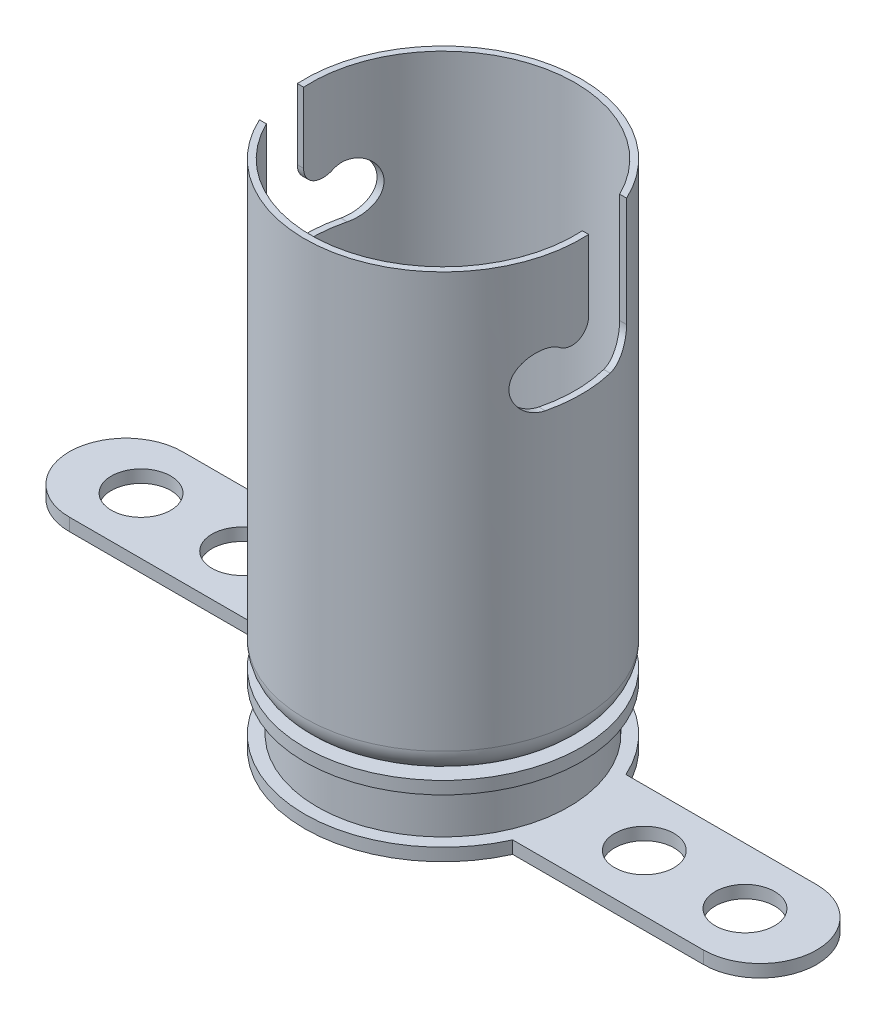
from build123d import *

# Parameters (mm, degrees)
SKETCH2_R           = 1.18
BOSS_EXTRUDE1_DEPTH = 0.5
SKETCH3_R           = 1.18
BOSS_EXTRUDE2_DEPTH = 0.5
CUT_EXTRUDE1_DEPTH  = 10
CIRPATTERN1_COUNT   = 2
CIRPATTERN1_ANGLE   = 180


with BuildPart() as part:
    # Sketch1 → Revolve1 (revolve)
    with BuildSketch(Plane.XY, mode=Mode.PRIVATE) as revolve1_sk:
        with BuildLine():
            Line((5.5, 20.3), (5.5, 3.8))
            ThreePointArc((5.5, 3.8), (5.207106781, 3.092893219), (4.5, 2.8))
            Line((4.5, 2.8), (5.5, 2.8))
            Line((5.5, 2.8), (5.5, 2.3))
            Line((5.5, 2.3), (5, 2.3))
            Line((5, 2.3), (5, 0.5))
            Line((5, 0.5), (5.5, 0.5))
            Line((5.5, 0.5), (5.5, 0))
            Line((5.5, 0), (0, 0))
            Line((0, 0), (0, 3.05))
            Line((0, 3.05), (4.5, 3.05))
            ThreePointArc((4.5, 3.05), (5.030330086, 3.269669914), (5.25, 3.8))
            Line((5.25, 3.8), (5.25, 20.3))
            Line((5.25, 20.3), (5.5, 20.3))
        make_face()
    revolve(revolve1_sk.sketch.rotate(Axis((0, -2.4, 0), (0, 1, 0)), 90), axis=Axis((0, -2.4, 0), (0, 1, 0)))

    # Sketch2 → Boss-Extrude1 (add)
    with BuildSketch(Plane.XZ):
        with BuildLine():
            Line((5.018714975, 2.25), (12.6, 2.25))
            ThreePointArc((12.6, 2.25), (14.85, 0), (12.6, -2.25))
            Line((12.6, -2.25), (5.018714975, -2.25))
            ThreePointArc((5.018714975, -2.25), (5.5, 0), (5.018714975, 2.25))
        make_face()
        with Locations(Location((12, 0, 0), (0, 0, 270))):
            Circle(SKETCH2_R, mode=Mode.SUBTRACT)
        with Locations(Location((8, 0, 0), (0, 0, 270))):
            Circle(SKETCH2_R, mode=Mode.SUBTRACT)
    extrude(amount=-BOSS_EXTRUDE1_DEPTH)

    # Sketch3 → Boss-Extrude2 (add)
    with BuildSketch(Plane.XZ.offset(-2.3)):
        with BuildLine():
            Line((-5.018714975, 2.25), (-12.6, 2.25))
            ThreePointArc((-12.6, 2.25), (-14.85, 0), (-12.6, -2.25))
            Line((-12.6, -2.25), (-5.018714975, -2.25))
            ThreePointArc((-5.018714975, -2.25), (-5.37833303, -1.150449399), (-5.5, 0))
            ThreePointArc((-5.5, 0), (-5.37833303, 1.150449399), (-5.018714975, 2.25))
        make_face()
        with Locations(Location((-12, 0, 0), (0, 0, 270))):
            Circle(SKETCH3_R, mode=Mode.SUBTRACT)
        with Locations(Location((-8, 0, 0), (0, 0, 270))):
            Circle(SKETCH3_R, mode=Mode.SUBTRACT)
    extrude(amount=-BOSS_EXTRUDE2_DEPTH)

    # Sketch4 → Cut-Extrude1 (cut)
    with BuildSketch(Plane(origin=(0, 0, 0), x_dir=(0, 0, -1), z_dir=(1, 0, 0))):
        with BuildLine():
            Line((2.298813226, 20.3), (2.298813226, 15.95))
            ThreePointArc((2.298813226, 15.95), (2.005920007, 15.242893219), (1.298813226, 14.95))
            Line((1.298813226, 14.95), (-1.283627995, 14.95))
            ThreePointArc((-1.283627995, 14.95), (-2.351186774, 16.017558779), (-1.283627995, 17.085117557))
            ThreePointArc((-1.283627995, 17.085117557), (-1.03323034, 17.046337207), (-0.806294362, 16.933629784))
            ThreePointArc((-0.806294362, 16.933629784), (-0.079626551, 16.883947504), (0.298813226, 17.506280029))
            Line((0.298813226, 17.506280029), (0.298813226, 20.3))
            Line((0.298813226, 20.3), (2.298813226, 20.3))
        make_face()
    cut_extrude1 = extrude(amount=CUT_EXTRUDE1_DEPTH, mode=Mode.SUBTRACT)

    # CirPattern1: Cut-Extrude1 ×2 about axis
    cirpattern1_axis = Axis((0, 20.3, 0), (0, -1, 0))
    for i in range(1, CIRPATTERN1_COUNT):
        add(cut_extrude1.rotate(cirpattern1_axis, i * CIRPATTERN1_ANGLE / (CIRPATTERN1_COUNT - 1)), mode=Mode.SUBTRACT)


solid = part.part
